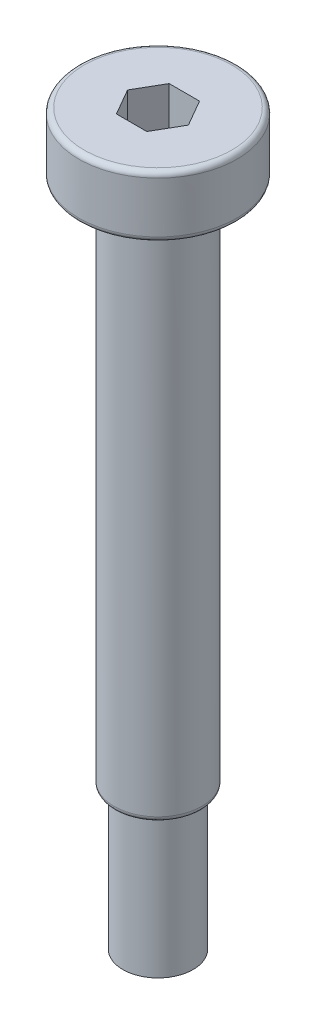
from build123d import *

# Parameters (mm, degrees)
FILLET_1_R          = 0.3
CUT_EXTRUDE_1_DEPTH = 2.4


with BuildPart() as part:
    # 草图1 → 旋转1 (revolve)
    with BuildSketch(Plane.XY):
        Polygon((0, 0), (-2, 0), (-2, 8), (-2.5, 8), (-2.5, 38), (-4.5, 38), (-4.5, 41.5), (0, 41.5), align=None)
    revolve(axis=Axis((0, 41.5, 0), (0, -1, 0)))

    # 圆角1
    fillet_1_edges = [part.edges().sort_by_distance(p)[0] for p in [
        (4.5, 41.5, 0),
        (4.5, 38, 0),
        (2.5, 8, 0),
    ]]
    fillet(fillet_1_edges, radius=FILLET_1_R)

    # 草图2 → 切除-拉伸1 (cut)
    with BuildSketch(Plane(origin=(0, 41.5, 0), x_dir=(1, 0, 0), z_dir=(0, 1, 0))):
        Polygon((0.866025404, -1.5), (1.732050808, 0), (0.866025404, 1.5), (-0.866025404, 1.5), (-1.732050808, 0), (-0.866025404, -1.5), align=None)
    extrude(amount=-CUT_EXTRUDE_1_DEPTH, mode=Mode.SUBTRACT)


solid = part.part
